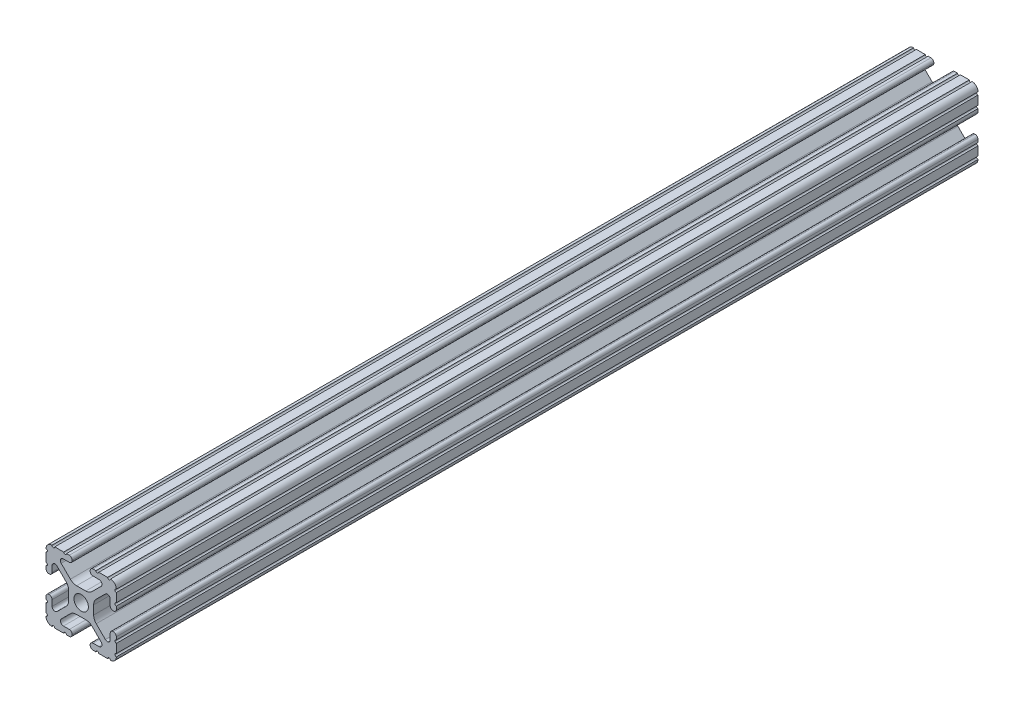
from build123d import *

# Parameters (mm, degrees)
SKETCH1_R           = 2.6035
BOSS_EXTRUDE1_DEPTH = 155.575


with BuildPart() as part:
    # Sketch1 → Boss-Extrude1 (new, symmetric)
    with BuildSketch(Plane.XY):
        with BuildLine():
            Line((-7.179650497, -8.645192506), (-3.952270251, -5.423690499))
            ThreePointArc((-3.952270251, -5.423690499), (-2.922936451, -4.736929036), (-1.709253557, -4.4958))
            Line((-1.709253557, -4.4958), (1.709253557, -4.4958))
            ThreePointArc((1.709253557, -4.4958), (2.922936451, -4.736929036), (3.952270251, -5.423690499))
            Line((3.952270251, -5.423690499), (7.179650497, -8.645192506))
            ThreePointArc((7.179650497, -8.645192506), (7.41473083, -9.822813117), (6.416408329, -10.4902))
            Line((6.416408329, -10.4902), (4.287512407, -10.4902))
            ThreePointArc((4.287512407, -10.4902), (3.54574862, -10.79744862), (3.2385, -11.539212407))
            Line((3.2385, -11.539212407), (3.2385, -11.650987593))
            ThreePointArc((3.2385, -11.650987593), (3.54574862, -12.39275138), (4.287512407, -12.7))
            Line((4.287512407, -12.7), (5.317126718, -12.7))
            ThreePointArc((5.317126718, -12.7), (5.825126718, -12.192), (6.333126718, -12.7))
            Line((6.333126718, -12.7), (9.550443118, -12.7))
            ThreePointArc((9.550443118, -12.7), (10.058366869, -12.192000006), (10.566443095, -12.699847501))
            ThreePointArc((10.566443095, -12.699847501), (12.082537762, -12.08250727), (12.699846982, -10.566399977))
            ThreePointArc((12.699846982, -10.566399977), (12.192000006, -10.058323491), (12.7, -9.5504))
            Line((12.7, -9.5504), (12.7, -6.3330836))
            ThreePointArc((12.7, -6.3330836), (12.192, -5.8250836), (12.7, -5.3170836))
            Line((12.7, -5.3170836), (12.7, -4.287469289))
            ThreePointArc((12.7, -4.287469289), (12.39275138, -3.545705502), (11.650987593, -3.238456882))
            Line((11.650987593, -3.238456882), (11.539212407, -3.238456882))
            ThreePointArc((11.539212407, -3.238456882), (10.79744862, -3.545705502), (10.4902, -4.287469289))
            Line((10.4902, -4.287469289), (10.4902, -6.402089023))
            ThreePointArc((10.4902, -6.402089023), (9.856505071, -7.351067942), (8.737131347, -7.129408934))
            Line((8.737131347, -7.129408934), (5.441005833, -3.840816462))
            ThreePointArc((5.441005833, -3.840816462), (4.750877967, -2.809883091), (4.5085, -1.593185507))
            Line((4.5085, -1.593185507), (4.5085, 1.593185507))
            ThreePointArc((4.5085, 1.593185507), (4.750877967, 2.809883091), (5.441005833, 3.840816462))
            Line((5.441005833, 3.840816462), (8.737131347, 7.129408934))
            ThreePointArc((8.737131347, 7.129408934), (9.856505071, 7.351067942), (10.4902, 6.402089023))
            Line((10.4902, 6.402089023), (10.4902, 4.287469289))
            ThreePointArc((10.4902, 4.287469289), (10.79744862, 3.545705502), (11.539212407, 3.238456882))
            Line((11.539212407, 3.238456882), (11.650987593, 3.238456882))
            ThreePointArc((11.650987593, 3.238456882), (12.39275138, 3.545705502), (12.7, 4.287469289))
            Line((12.7, 4.287469289), (12.7, 5.3170836))
            ThreePointArc((12.7, 5.3170836), (12.192, 5.8250836), (12.7, 6.3330836))
            Line((12.7, 6.3330836), (12.7, 9.5504))
            ThreePointArc((12.7, 9.5504), (12.192000006, 10.058323491), (12.699846982, 10.566399977))
            ThreePointArc((12.699846982, 10.566399977), (12.082537762, 12.08250727), (10.566443095, 12.699847501))
            ThreePointArc((10.566443095, 12.699847501), (10.058366869, 12.192000006), (9.550443118, 12.7))
            Line((9.550443118, 12.7), (6.333126718, 12.7))
            ThreePointArc((6.333126718, 12.7), (5.825126718, 12.192), (5.317126718, 12.7))
            Line((5.317126718, 12.7), (4.287512407, 12.7))
            ThreePointArc((4.287512407, 12.7), (3.54574862, 12.39275138), (3.2385, 11.650987593))
            Line((3.2385, 11.650987593), (3.2385, 11.539212407))
            ThreePointArc((3.2385, 11.539212407), (3.54574862, 10.79744862), (4.287512407, 10.4902))
            Line((4.287512407, 10.4902), (6.476788598, 10.4902))
            ThreePointArc((6.476788598, 10.4902), (7.432222385, 9.85140422), (7.207036008, 8.724370562))
            Line((7.207036008, 8.724370562), (3.898272566, 5.423169045))
            ThreePointArc((3.898272566, 5.423169045), (2.869120213, 4.736787962), (1.655778399, 4.4958))
            Line((1.655778399, 4.4958), (-1.655778399, 4.4958))
            ThreePointArc((-1.655778399, 4.4958), (-2.869120213, 4.736787962), (-3.898272566, 5.423169045))
            Line((-3.898272566, 5.423169045), (-7.207036008, 8.724370562))
            ThreePointArc((-7.207036008, 8.724370562), (-7.432222385, 9.85140422), (-6.476788598, 10.4902))
            Line((-6.476788598, 10.4902), (-4.287512407, 10.4902))
            ThreePointArc((-4.287512407, 10.4902), (-3.54574862, 10.79744862), (-3.2385, 11.539212407))
            Line((-3.2385, 11.539212407), (-3.2385, 11.650987593))
            ThreePointArc((-3.2385, 11.650987593), (-3.54574862, 12.39275138), (-4.287512407, 12.7))
            Line((-4.287512407, 12.7), (-5.317126718, 12.7))
            ThreePointArc((-5.317126718, 12.7), (-5.825126718, 12.192), (-6.333126718, 12.7))
            Line((-6.333126718, 12.7), (-9.550443118, 12.7))
            ThreePointArc((-9.550443118, 12.7), (-10.058366869, 12.192000006), (-10.566443095, 12.699847501))
            ThreePointArc((-10.566443095, 12.699847501), (-12.082537762, 12.08250727), (-12.699846982, 10.566399977))
            ThreePointArc((-12.699846982, 10.566399977), (-12.192000006, 10.058323491), (-12.7, 9.5504))
            Line((-12.7, 9.5504), (-12.7, 6.3330836))
            ThreePointArc((-12.7, 6.3330836), (-12.192, 5.8250836), (-12.7, 5.3170836))
            Line((-12.7, 5.3170836), (-12.7, 4.287469289))
            ThreePointArc((-12.7, 4.287469289), (-12.39275138, 3.545705502), (-11.650987593, 3.238456882))
            Line((-11.650987593, 3.238456882), (-11.539212407, 3.238456882))
            ThreePointArc((-11.539212407, 3.238456882), (-10.79744862, 3.545705502), (-10.4902, 4.287469289))
            Line((-10.4902, 4.287469289), (-10.4902, 6.402089023))
            ThreePointArc((-10.4902, 6.402089023), (-9.856505071, 7.351067942), (-8.737131347, 7.129408934))
            Line((-8.737131347, 7.129408934), (-5.441005833, 3.840816462))
            ThreePointArc((-5.441005833, 3.840816462), (-4.750877967, 2.809883091), (-4.5085, 1.593185507))
            Line((-4.5085, 1.593185507), (-4.5085, -1.593185507))
            ThreePointArc((-4.5085, -1.593185507), (-4.750877967, -2.809883091), (-5.441005833, -3.840816462))
            Line((-5.441005833, -3.840816462), (-8.737131347, -7.129408934))
            ThreePointArc((-8.737131347, -7.129408934), (-9.856505071, -7.351067942), (-10.4902, -6.402089023))
            Line((-10.4902, -6.402089023), (-10.4902, -4.287469289))
            ThreePointArc((-10.4902, -4.287469289), (-10.79744862, -3.545705502), (-11.539212407, -3.238456882))
            Line((-11.539212407, -3.238456882), (-11.650987593, -3.238456882))
            ThreePointArc((-11.650987593, -3.238456882), (-12.39275138, -3.545705502), (-12.7, -4.287469289))
            Line((-12.7, -4.287469289), (-12.7, -5.3170836))
            ThreePointArc((-12.7, -5.3170836), (-12.192, -5.8250836), (-12.7, -6.3330836))
            Line((-12.7, -6.3330836), (-12.7, -9.5504))
            ThreePointArc((-12.7, -9.5504), (-12.192000006, -10.058323491), (-12.699846982, -10.566399977))
            ThreePointArc((-12.699846982, -10.566399977), (-12.082537762, -12.08250727), (-10.566443095, -12.699847501))
            ThreePointArc((-10.566443095, -12.699847501), (-10.058366869, -12.192000006), (-9.550443118, -12.7))
            Line((-9.550443118, -12.7), (-6.333126718, -12.7))
            ThreePointArc((-6.333126718, -12.7), (-5.825126718, -12.192), (-5.317126718, -12.7))
            Line((-5.317126718, -12.7), (-4.287512407, -12.7))
            ThreePointArc((-4.287512407, -12.7), (-3.54574862, -12.39275138), (-3.2385, -11.650987593))
            Line((-3.2385, -11.650987593), (-3.2385, -11.539212407))
            ThreePointArc((-3.2385, -11.539212407), (-3.54574862, -10.79744862), (-4.287512407, -10.4902))
            Line((-4.287512407, -10.4902), (-6.416408329, -10.4902))
            ThreePointArc((-6.416408329, -10.4902), (-7.41473083, -9.822813117), (-7.179650497, -8.645192506))
        make_face()
        Circle(SKETCH1_R, mode=Mode.SUBTRACT)
    extrude(amount=BOSS_EXTRUDE1_DEPTH, both=True)


solid = part.part
